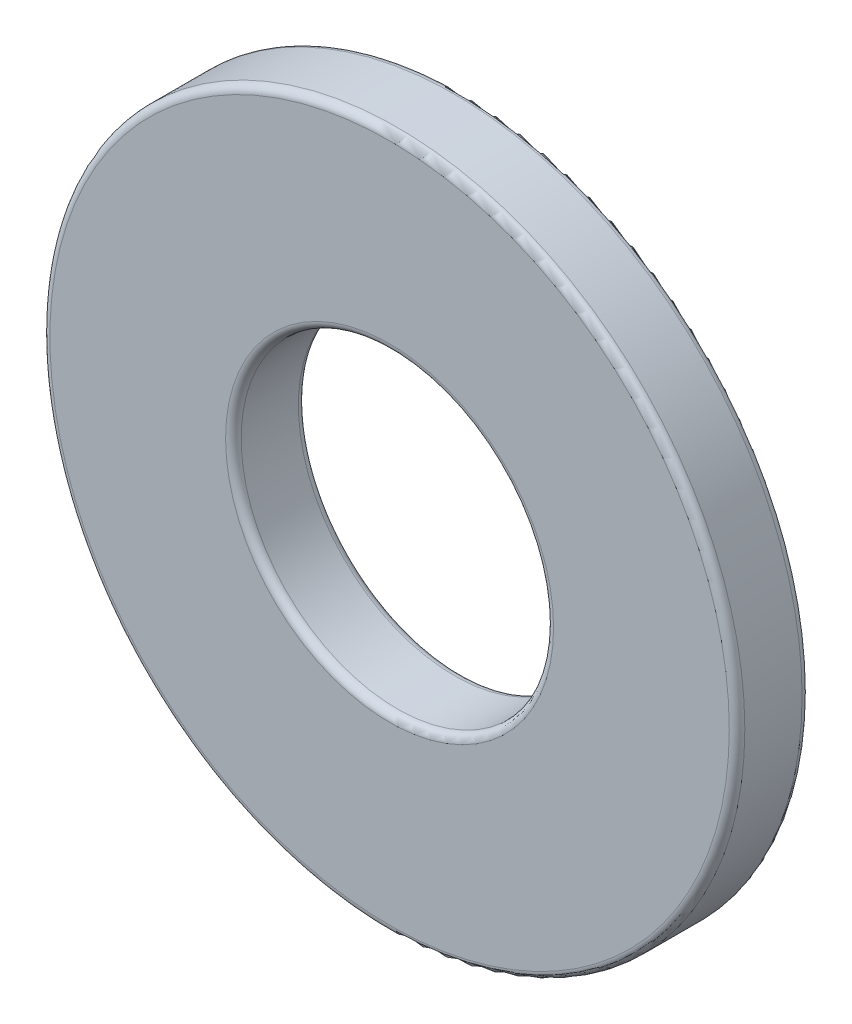
from build123d import *

# Parameters (mm, degrees)
SKETCH1_R           = 7.9375
SKETCH1_R_2         = 3.5687
BOSS_EXTRUDE1_DEPTH = 0.83185
FILLET2_R           = 0.1778


with BuildPart() as part:
    # Sketch1 → Boss-Extrude1 (new, symmetric)
    with BuildSketch(Plane(origin=(0, 0, 0), x_dir=(0, 1, 0), z_dir=(0, 0, 1))):
        with Locations(Location((0, 0, 0), (0, 0, 270))):
            Circle(SKETCH1_R)
        with Locations(Location((0, 0, 0), (0, 0, 270))):
            Circle(SKETCH1_R_2, mode=Mode.SUBTRACT)
    extrude(amount=BOSS_EXTRUDE1_DEPTH, both=True)

    # Fillet2
    fillet2_edges = [part.edges().sort_by_distance(p)[0] for p in [
        (-7.9375, 0, -0.83185),
        (-7.9375, 0, 0.83185),
        (-3.5687, 0, -0.83185),
        (-3.5687, 0, 0.83185),
    ]]
    fillet(fillet2_edges, radius=FILLET2_R)


solid = part.part
